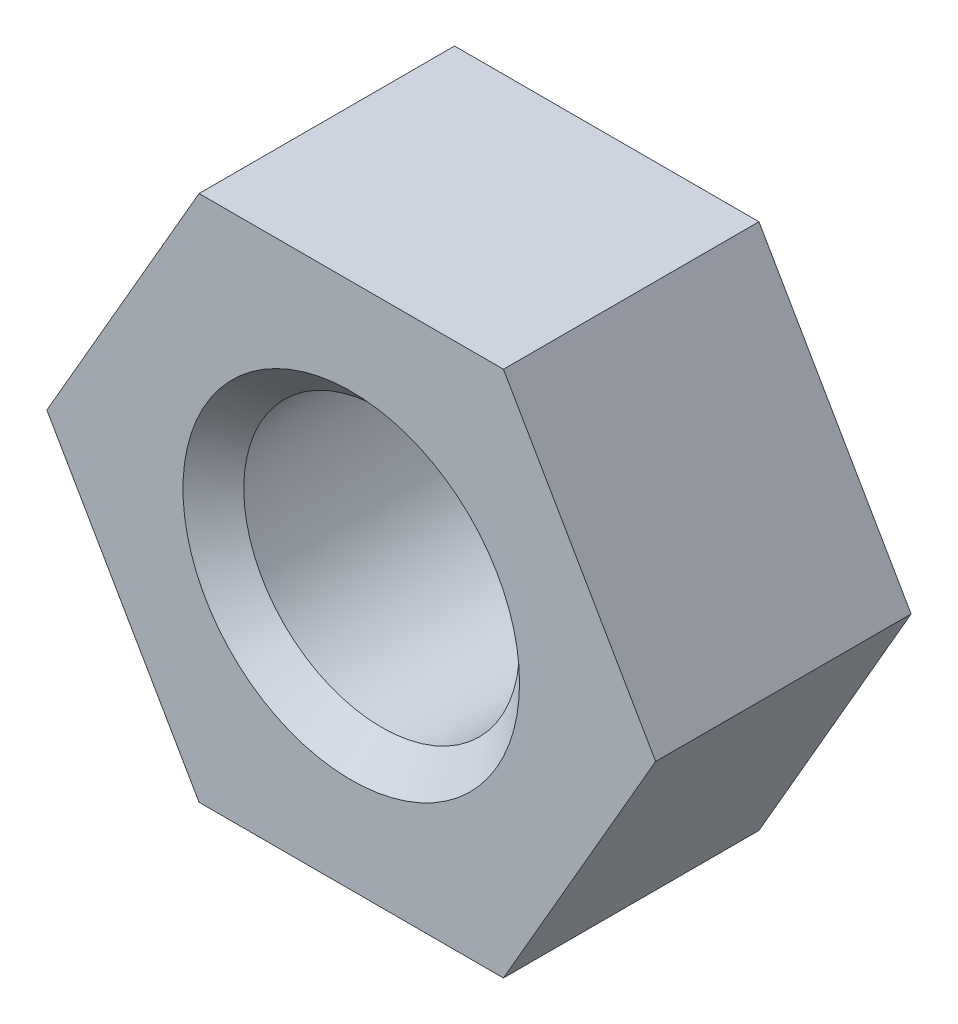
from build123d import *

# Parameters (mm, degrees)
SKETCH1_R           = 3.4
BOSS_EXTRUDE1_DEPTH = 6.3
CHAMFER1_SIZE       = 0.75


with BuildPart() as part:
    # Sketch1 → Boss-Extrude1 (new body)
    with BuildSketch(Plane.XY):
        Polygon((7.505553499, 0), (3.75277675, 6.5), (-3.75277675, 6.5), (-7.505553499, 0), (-3.75277675, -6.5), (3.75277675, -6.5), align=None)
        Circle(SKETCH1_R, mode=Mode.SUBTRACT)
    extrude(amount=BOSS_EXTRUDE1_DEPTH)

    # Chamfer1
    chamfer1_edges = [part.edges().sort_by_distance(p)[0] for p in [
        (-3.4, 0, 0),
        (-3.4, 0, 6.3),
    ]]
    chamfer(chamfer1_edges, length=CHAMFER1_SIZE)


solid = part.part
